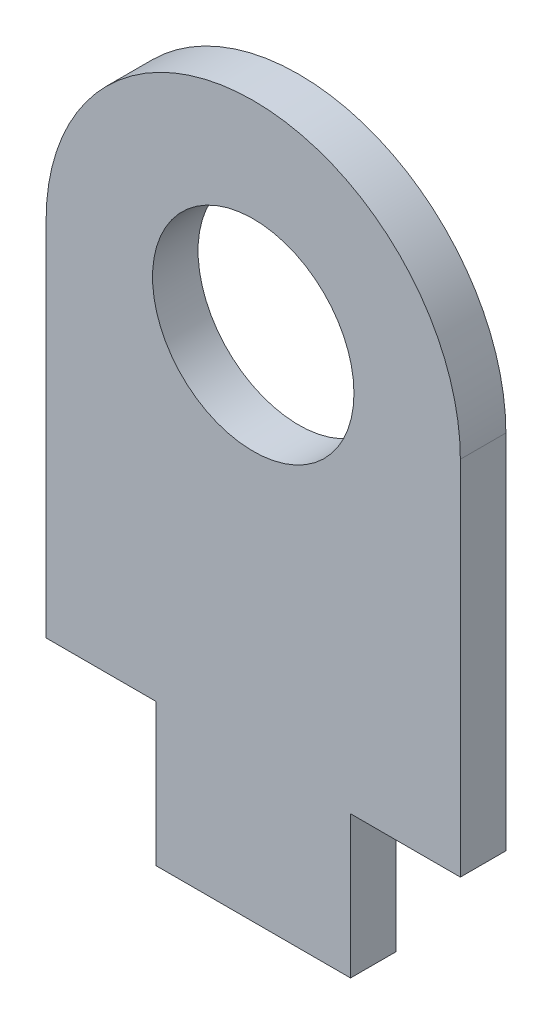
from build123d import *

# Parameters (mm, degrees)
BOSS_EXTRUDE1_DEPTH = 0.508
SKETCH2_R           = 2.2479
CUT_EXTRUDE1_DEPTH  = 11.636172283
FILLET1_RADIUS      = 4.6228
FILLET1_LENGTH      = 1.016


with BuildPart() as part:
    # Sketch1 → Boss-Extrude1 (new, symmetric)
    with BuildSketch(Plane.XY):
        Polygon((-4.6228, 6.35), (4.6228, 6.35), (4.6228, -6.35), (2.1717, -6.35), (2.1717, -9.525), (-2.1717, -9.525), (-2.1717, -6.35), (-4.6228, -6.35), align=None)
    extrude(amount=BOSS_EXTRUDE1_DEPTH, both=True)

    # Sketch2 → Cut-Extrude1 (cut, through all)
    with BuildSketch(Plane.XY.offset(0.508)):
        with Locations((0, 1.8161)):
            Circle(SKETCH2_R)
    extrude(amount=-CUT_EXTRUDE1_DEPTH, mode=Mode.SUBTRACT)

    # Fillet1: full round fillet: the end face becomes a half cylinder, R = half its width
    fillet1_face = Plane((0, 6.35, 0), x_dir=(0, 0, 1), z_dir=(0, 1, 0))  # on the end face: x along it, z out of the body
    fillet1_slab = fillet1_face.offset(-FILLET1_RADIUS / 2) * Box(FILLET1_LENGTH, 2 * FILLET1_RADIUS, FILLET1_RADIUS, mode=Mode.PRIVATE)  # the body's end, R deep
    fillet1_round = Plane((0, 1.7272, 0), x_dir=(0, 1, 0), z_dir=(0, 0, 1)) * Cylinder(FILLET1_RADIUS, FILLET1_LENGTH, mode=Mode.PRIVATE)  # its axis R under the face
    add(fillet1_slab - fillet1_round, mode=Mode.SUBTRACT)


solid = part.part
